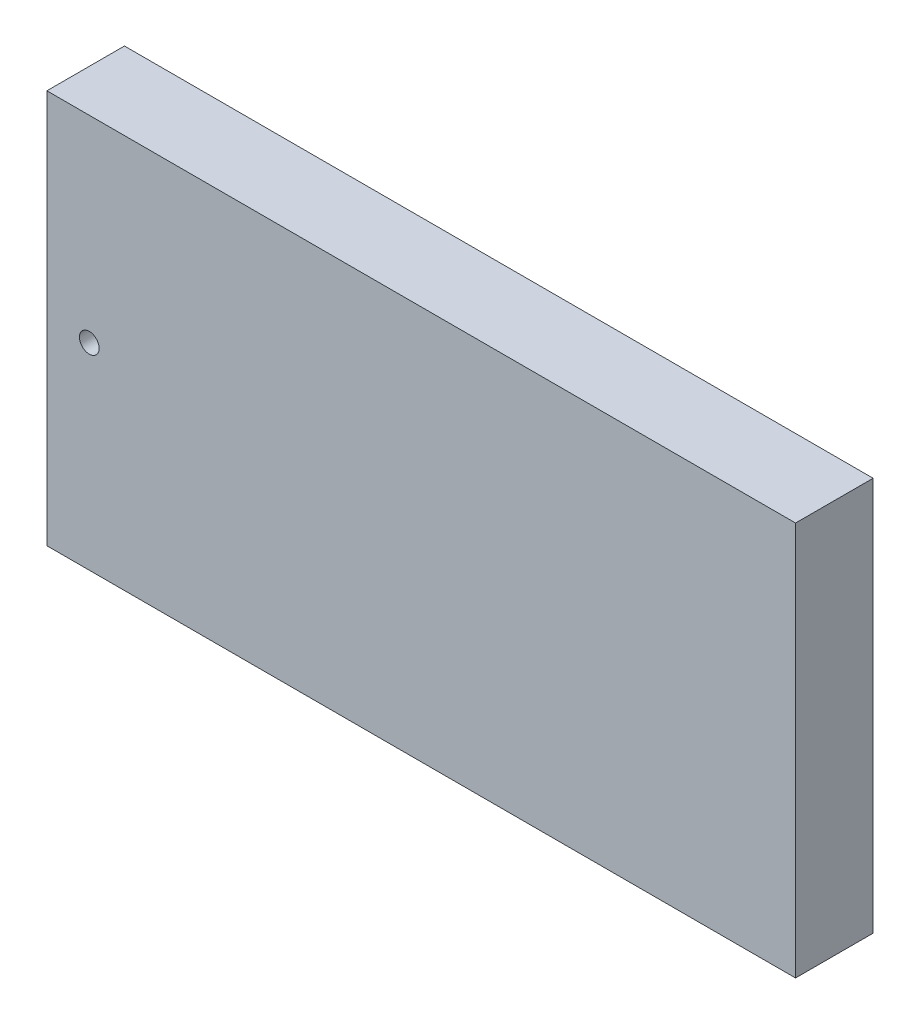
from build123d import *

# Parameters (mm, degrees)
SKETCH1_W               = 965.2
SKETCH1_H               = 508
BOSS_EXTRUDE1_DEPTH     = 100
CUT_EXTRUDE1_DEPTH      = 555.453568841
CUT_EXTRUDE1_DEPTH_BACK = 555.453568841
SKETCH2_R               = 12.7


with BuildPart() as part:
    # Sketch1 → Boss-Extrude1 (new body)
    with BuildSketch(Plane.XY):
        Rectangle(SKETCH1_W, SKETCH1_H)
    extrude(amount=-BOSS_EXTRUDE1_DEPTH)

    # Sketch2 → Cut-Extrude1 (cut, two sides: drawn at the far end of the back side and taken through both)
    with BuildSketch(Plane.XY.offset(-CUT_EXTRUDE1_DEPTH_BACK)):
        with Locations((-427.956480022, 0)):
            Circle(SKETCH2_R)
    extrude(amount=CUT_EXTRUDE1_DEPTH + CUT_EXTRUDE1_DEPTH_BACK, mode=Mode.SUBTRACT)


solid = part.part
